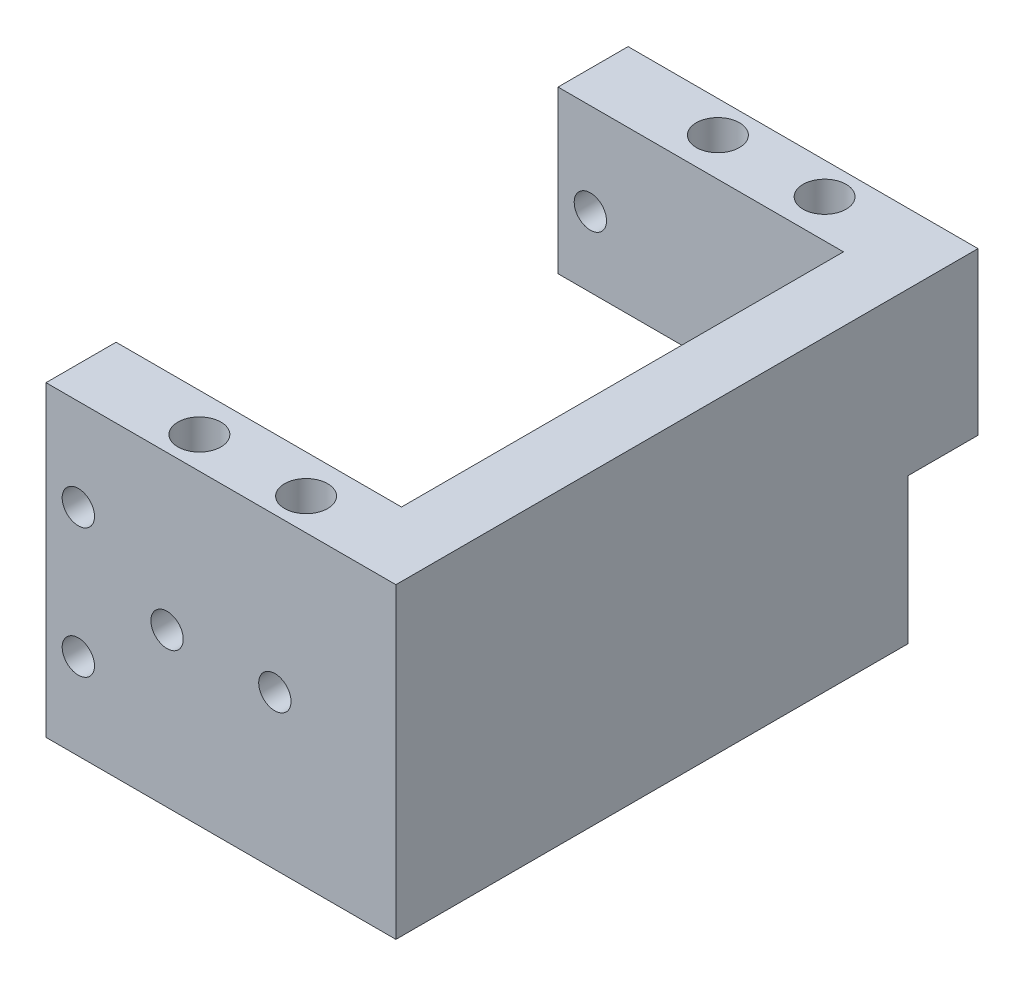
from build123d import *

# Parameters (mm, degrees)
BOSS_EXTRUDE1_DEPTH = 28.5
SKETCH2_4_R         = 1.5
CUT_EXTRUDE1_DEPTH  = 15
SKETCH3_W           = 6.5
SKETCH3_H           = 15
BOSS_EXTRUDE2_DEPTH = 32.46
SKETCH2_5_R         = 2
CUT_EXTRUDE2_DEPTH  = 94.46
SKETCH2_6_R         = 2
CUT_EXTRUDE4_DEPTH  = 8
CUT_EXTRUDE5_START  = -8
SKETCH5_R           = 2
CUT_EXTRUDE5_DEPTH  = 8
SKETCH4_R           = 1.5
CUT_EXTRUDE3_DEPTH  = 10
SKETCH4_3_R         = 3
SKETCH4_3_R_2       = 1.5
CUT_EXTRUDE6_DEPTH  = 3.5
CUT_EXTRUDE7_REACH  = 54.735
SKETCH11_W          = 41
SKETCH11_H          = 28.5
SKETCH12_R          = 1.5
CUT_EXTRUDE8_DEPTH  = 64


with BuildPart() as part:
    # Sketch2 → Boss-Extrude1 (new body)
    with BuildSketch(Plane(origin=(0, 0, 0), x_dir=(1, 0, 0), z_dir=(0, 1, 0))):
        Polygon((-10.25, 23.75), (-16.23, 23.75), (-16.23, -23.75), (16.23, -23.75), (16.23, 23.75), (10.25, 23.75), (10.25, -17.25), (-10.25, -17.25), align=None)
    extrude(amount=BOSS_EXTRUDE1_DEPTH)

    # Sketch2<4> → Cut-Extrude1 (cut)
    with BuildSketch(Plane(origin=(0, 0, 0), x_dir=(1, 0, 0), z_dir=(0, 1, 0))):
        with Locations((-13.23, 19.75)):
            Circle(SKETCH2_4_R)
        with Locations((13.23, 19.75)):
            Circle(SKETCH2_4_R)
        with Locations((13.23, -13.25)):
            Circle(SKETCH2_4_R)
        with Locations((-13.23, -13.25)):
            Circle(SKETCH2_4_R)
    extrude(amount=CUT_EXTRUDE1_DEPTH, mode=Mode.SUBTRACT)

    # Sketch3 → Boss-Extrude2 (add)
    with BuildSketch(Plane.ZY.offset(16.23)):
        with Locations((-27, 21)):
            Rectangle(SKETCH3_W, SKETCH3_H)
    extrude(amount=-BOSS_EXTRUDE2_DEPTH)

    # Sketch2<5> → Cut-Extrude2 (cut)
    with BuildSketch(Plane(origin=(0, 0, 0), x_dir=(1, 0, 0), z_dir=(0, 1, 0))):
        with Locations((-4.95, 27.3)):
            Circle(SKETCH2_5_R)
        with Locations((4.95, 27.3)):
            Circle(SKETCH2_5_R)
    extrude(amount=CUT_EXTRUDE2_DEPTH, mode=Mode.SUBTRACT)

    # Sketch2<6> → Cut-Extrude4 (cut)
    with BuildSketch(Plane(origin=(0, 0, 0), x_dir=(1, 0, 0), z_dir=(0, 1, 0))):
        with Locations((4.95, -20.8)):
            Circle(SKETCH2_6_R)
        with Locations((-4.95, -20.8)):
            Circle(SKETCH2_6_R)
    extrude(amount=CUT_EXTRUDE4_DEPTH, mode=Mode.SUBTRACT)

    # Sketch5 → Cut-Extrude5 (cut)
    with BuildSketch(Plane(origin=(0, 28.5, 0), x_dir=(1, 0, 0), z_dir=(0, 1, 0)).offset(CUT_EXTRUDE5_START)):
        with Locations((-4.95, -20.8)):
            Circle(SKETCH5_R)
        with Locations((4.95, -20.8)):
            Circle(SKETCH5_R)
    extrude(amount=CUT_EXTRUDE5_DEPTH, mode=Mode.SUBTRACT)

    # Sketch4 → Cut-Extrude3 (cut)
    with BuildSketch(Plane(origin=(0, 0, 17.25), x_dir=(-1, 0, 0), z_dir=(0, 0, -1))):
        with Locations((-5, 14.25)):
            Circle(SKETCH4_R)
        with Locations((5, 14.25)):
            Circle(SKETCH4_R)
    extrude(amount=-CUT_EXTRUDE3_DEPTH, mode=Mode.SUBTRACT)

    # Sketch4<3> → Cut-Extrude6 (cut)
    # profile 1 of 2: a face of its own
    with BuildSketch(Plane(origin=(0, 0, 17.25), x_dir=(-1, 0, 0), z_dir=(0, 0, -1))):
        with Locations((-5, 14.25)):
            Circle(SKETCH4_3_R)
        with Locations((-5, 14.25)):
            Circle(SKETCH4_3_R_2, mode=Mode.SUBTRACT)
    # profile 2 of 2: a face of its own
    with BuildSketch(Plane(origin=(0, 0, 17.25), x_dir=(-1, 0, 0), z_dir=(0, 0, -1))):
        with Locations((5, 14.25)):
            Circle(SKETCH4_3_R)
        with Locations((5, 14.25)):
            Circle(SKETCH4_3_R_2, mode=Mode.SUBTRACT)
    extrude(amount=-CUT_EXTRUDE6_DEPTH, mode=Mode.SUBTRACT)

    # Sketch11 → Cut-Extrude7 (cut, up to next)
    with BuildSketch(Plane.ZY.offset(16.23), mode=Mode.PRIVATE) as cut_extrude7_sk1:
        with Locations((-3.25, 14.25)):
            Rectangle(SKETCH11_W, SKETCH11_H)
    cut_extrude7_tool1 = extrude(cut_extrude7_sk1.sketch, amount=-CUT_EXTRUDE7_REACH, mode=Mode.PRIVATE) & part.part
    add(cut_extrude7_tool1.solids().sort_by_distance((-16.23, 14.25, -3.25))[0], mode=Mode.SUBTRACT)

    # Sketch12 → Cut-Extrude8 (cut)
    with BuildSketch(Plane(origin=(0, 0, -30.25), x_dir=(-1, 0, 0), z_dir=(0, 0, -1))):
        with Locations((13.23, 20)):
            Circle(SKETCH12_R)
        with Locations((13.23, 8)):
            Circle(SKETCH12_R)
    extrude(amount=-CUT_EXTRUDE8_DEPTH, mode=Mode.SUBTRACT)


solid = part.part
